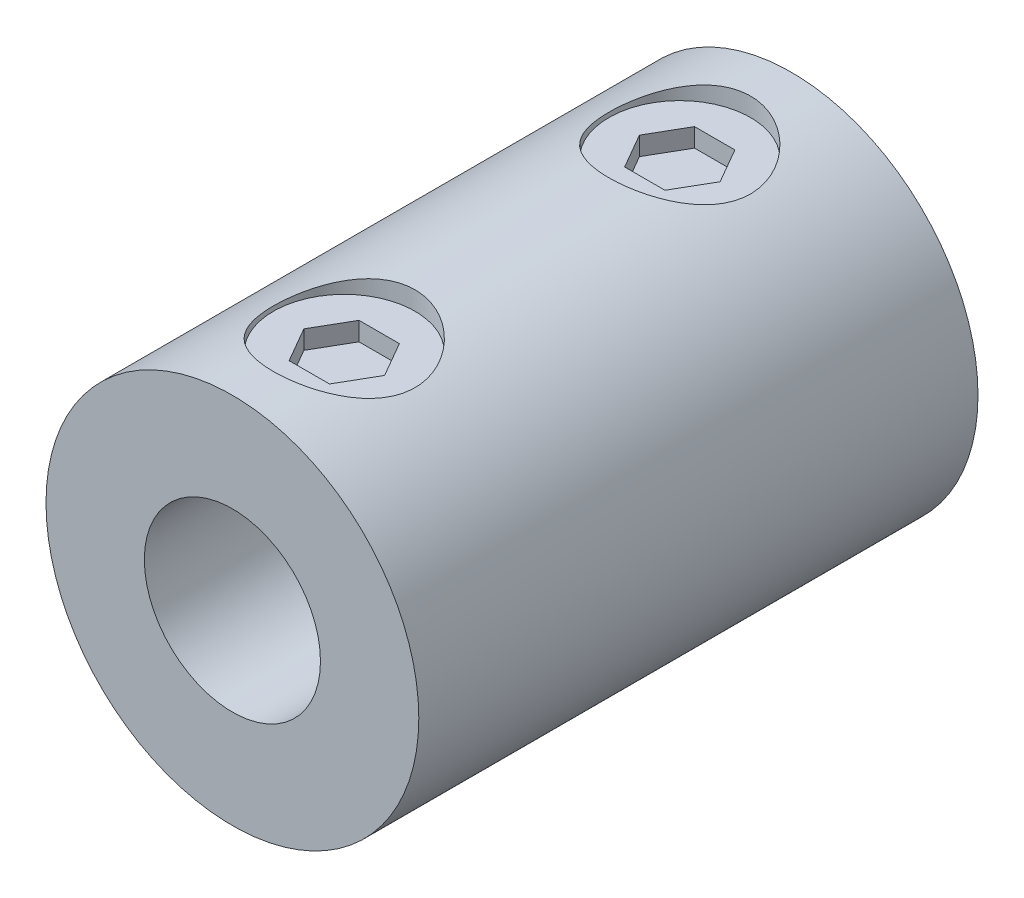
from build123d import *

# Parameters (mm, degrees)
SKETCH4_R           = 2.413
CUT_EXTRUDE1_DEPTH  = 1.27
BOSS_EXTRUDE1_START = 0.635
SKETCH3_R           = 2.413
BOSS_EXTRUDE1_DEPTH = 0.635


with BuildPart() as part:
    # Sketch2 → Revolve1 (revolve)
    with BuildSketch(Plane(origin=(0, 0, 0), x_dir=(0, 0, -1), z_dir=(1, 0, 0)), mode=Mode.PRIVATE) as revolve1_sk:
        Polygon((0, 3), (0, 6.35), (19.05, 6.35), (19.05, 3.96875), (9.525, 3.96875), (9.525, 3), align=None)
    revolve(revolve1_sk.sketch.rotate(Axis((0, 0, 0), (0, 0, -1)), 90), axis=Axis((0, 0, 0), (0, 0, -1)))

    # Sketch4 → Cut-Extrude1 (cut)
    with BuildSketch(Plane(origin=(0, 6.35, 0), x_dir=(1, 0, 0), z_dir=(0, 1, 0))):
        with Locations(Location((0, 3.81, 0), (0, 0, 270))):
            Circle(SKETCH4_R)
    cut_extrude1 = extrude(amount=-CUT_EXTRUDE1_DEPTH, mode=Mode.SUBTRACT)

    # Sketch3 → Boss-Extrude1 (add)
    with BuildSketch(Plane(origin=(0, 5.08, 0), x_dir=(1, 0, 0), z_dir=(0, 1, 0)).offset(BOSS_EXTRUDE1_START)):
        with Locations(Location((0, 3.81, 0), (0, 0, 270))):
            Circle(SKETCH3_R)
        Polygon((1.374815329, 3.81), (0.687407664, 5.000625), (-0.687407664, 5.000625), (-1.374815329, 3.81), (-0.687407664, 2.619375), (0.687407664, 2.619375), align=None, mode=Mode.SUBTRACT)
    boss_extrude1 = extrude(amount=-BOSS_EXTRUDE1_DEPTH)

    # Mirror1: Cut-Extrude1, Boss-Extrude1 across plane
    add(cut_extrude1.mirror(Plane.XY.offset(-9.525)), mode=Mode.SUBTRACT)
    add(boss_extrude1.mirror(Plane.XY.offset(-9.525)))


solid = part.part
